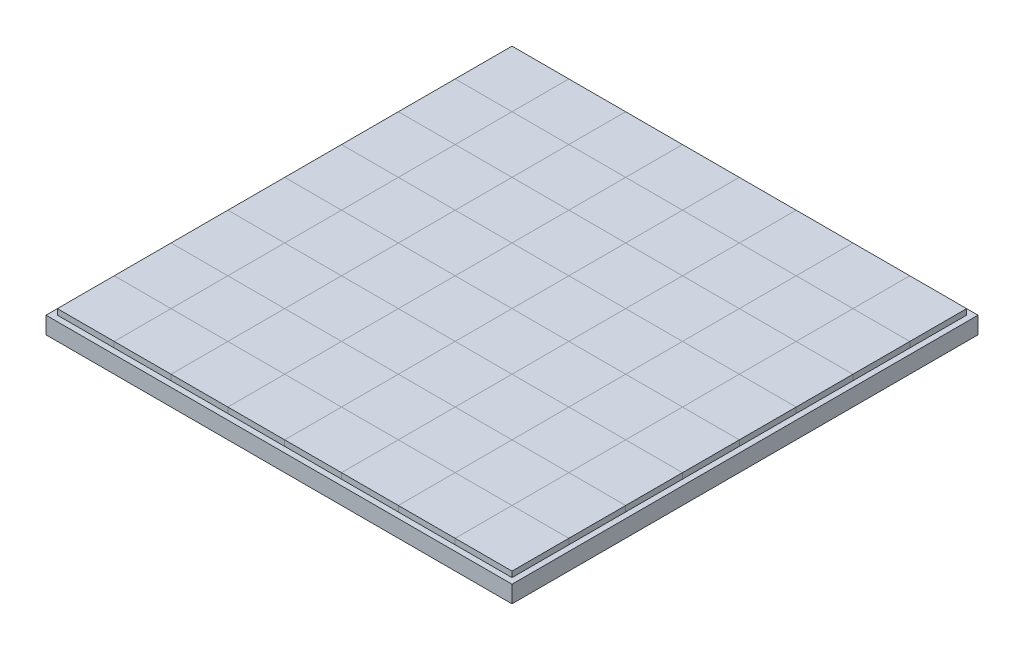
from build123d import *

# Parameters (mm, degrees)
SKETCH1_W            = 410
SKETCH1_H            = 410
BOSS_EXTRUDE3_DEPTH  = 15
SKETCH2_W            = 50
SKETCH2_H            = 50
BOSS_EXTRUDE4_DEPTH  = 5
LPATTERN2_COUNT      = 4
LPATTERN2_PITCH      = 100
LPATTERN2_COUNT_DIR2 = 4
LPATTERN2_PITCH_DIR2 = 100
SKETCH3_W            = 50
SKETCH3_H            = 50
BOSS_EXTRUDE6_DEPTH  = 5
LPATTERN3_COUNT      = 4
LPATTERN3_PITCH      = 100
LPATTERN3_COUNT_DIR2 = 4
LPATTERN3_PITCH_DIR2 = 100
SKETCH5_W            = 50
SKETCH5_H            = 50
BOSS_EXTRUDE7_DEPTH  = 5
LPATTERN4_COUNT      = 4
LPATTERN4_PITCH      = 100
LPATTERN4_COUNT_DIR2 = 4
LPATTERN4_PITCH_DIR2 = 100
SKETCH6_W            = 50
SKETCH6_H            = 50
BOSS_EXTRUDE8_DEPTH  = 5
LPATTERN5_COUNT      = 4
LPATTERN5_PITCH      = 100
LPATTERN5_COUNT_DIR2 = 4
LPATTERN5_PITCH_DIR2 = 100


with BuildPart() as part:
    # Sketch1 → Boss-Extrude3 (new body)
    with BuildSketch(Plane(origin=(0, 0, 0), x_dir=(1, 0, 0), z_dir=(0, 1, 0))):
        with Locations((5, -5)):
            Rectangle(SKETCH1_W, SKETCH1_H)
    extrude(amount=BOSS_EXTRUDE3_DEPTH)

    # Sketch2 → Boss-Extrude4 (add)
    with BuildSketch(Plane(origin=(0, 15, 0), x_dir=(1, 0, 0), z_dir=(0, 1, 0))):
        with Locations((-170, 170)):
            Rectangle(SKETCH2_W, SKETCH2_H)
    boss_extrude4 = extrude(amount=BOSS_EXTRUDE4_DEPTH)

    # LPattern2: Boss-Extrude4 4 × 4
    with Locations(*[(i * LPATTERN2_PITCH, 0, j * LPATTERN2_PITCH_DIR2) for i in range(LPATTERN2_COUNT) for j in range(LPATTERN2_COUNT_DIR2) if (i, j) != (0, 0)]):
        add(boss_extrude4)


with BuildPart() as body_2:
    # Sketch3 → Boss-Extrude6 (new body)
    with BuildSketch(Plane(origin=(0, 15, 0), x_dir=(1, 0, 0), z_dir=(0, 1, 0))):
        with Locations((-120, 170)):
            Rectangle(SKETCH3_W, SKETCH3_H)
    boss_extrude6 = extrude(amount=BOSS_EXTRUDE6_DEPTH)


with BuildPart() as lpattern3_1:
    # LPattern3: Boss-Extrude6 4 × 4
    with Locations(*[(i * LPATTERN3_PITCH, 0, j * LPATTERN3_PITCH_DIR2) for i in range(LPATTERN3_COUNT) for j in range(LPATTERN3_COUNT_DIR2) if (i, j) != (0, 0)]):
        add(boss_extrude6)


with BuildPart() as body_18:
    # Sketch5 → Boss-Extrude7 (new body)
    with BuildSketch(Plane(origin=(0, 15, 0), x_dir=(1, 0, 0), z_dir=(0, 1, 0))):
        with Locations((-170, 120)):
            Rectangle(SKETCH5_W, SKETCH5_H)
    boss_extrude7 = extrude(amount=BOSS_EXTRUDE7_DEPTH)


with BuildPart() as lpattern4_1:
    # LPattern4: Boss-Extrude7 4 × 4
    with Locations(*[(i * LPATTERN4_PITCH, 0, j * LPATTERN4_PITCH_DIR2) for i in range(LPATTERN4_COUNT) for j in range(LPATTERN4_COUNT_DIR2) if (i, j) != (0, 0)]):
        add(boss_extrude7)


with BuildPart() as body_34:
    # Sketch6 → Boss-Extrude8 (new body)
    with BuildSketch(Plane(origin=(0, 15, 0), x_dir=(1, 0, 0), z_dir=(0, 1, 0))):
        with Locations((-120, 120)):
            Rectangle(SKETCH6_W, SKETCH6_H)
    boss_extrude8 = extrude(amount=BOSS_EXTRUDE8_DEPTH)


with BuildPart() as lpattern5_1:
    # LPattern5: Boss-Extrude8 4 × 4
    with Locations(*[(i * LPATTERN5_PITCH, 0, j * LPATTERN5_PITCH_DIR2) for i in range(LPATTERN5_COUNT) for j in range(LPATTERN5_COUNT_DIR2) if (i, j) != (0, 0)]):
        add(boss_extrude8)


solid = Compound([part.part, body_2.part, lpattern3_1.part, body_18.part, lpattern4_1.part, body_34.part, lpattern5_1.part])
